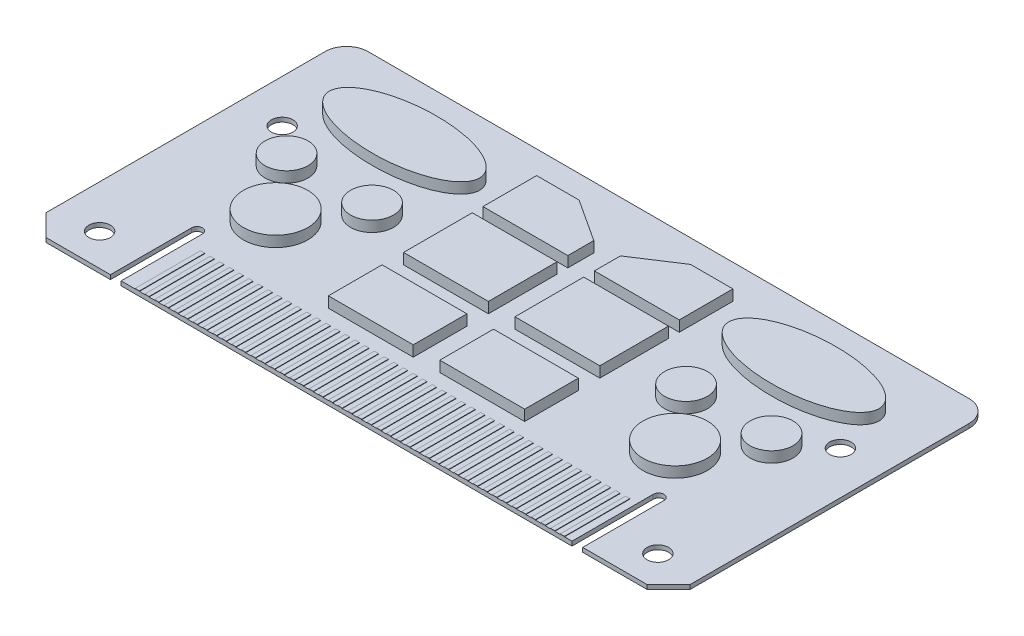
from build123d import *

# Parameters (mm, degrees)
SKETCH1_W                   = 300
SKETCH1_H                   = 150
BOSS_EXTRUDE3_DEPTH         = 2
CHAMFER2_SIZE               = 10
CHAMFER3_SIZE               = 10
FILLET1_R                   = 10
FILLET2_R                   = 10
SKETCH3_R                   = 5
CUT_EXTRUDE1_DEPTH          = 168.717023584
SKETCH4_R                   = 5
CUT_EXTRUDE2_DEPTH          = 168.717023584
CUT_EXTRUDE3_DEPTH          = 168.717023584
BOSS_EXTRUDE4_DEPTH         = 5
BOSS_EXTRUDE4_DEPTH_BACK    = 5
SKETCH6_RX                  = 35
SKETCH6_RY                  = 15
BOSS_EXTRUDE5_DEPTH         = 5
BOSS_EXTRUDE5_DEPTH_BACK    = 5
SKETCH7_R                   = 10
SKETCH7_R_2                 = 15
SKETCH7_W                   = 39.518903324
SKETCH7_H                   = 32
SKETCH7_H_2                 = 25
BOSS_EXTRUDE6_DEPTH         = 0.2
BOSS_EXTRUDE6_DEPTH_BACK    = 0.2
SKETCH12_W                  = 2
SKETCH12_H                  = 30.467504463
BOSS_EXTRUDE6_2_DEPTH       = 0.2
BOSS_EXTRUDE6_2_DEPTH_BACK  = 0.2
BOSS_EXTRUDE6_3_DEPTH       = 0.2
BOSS_EXTRUDE6_3_DEPTH_BACK  = 0.2
BOSS_EXTRUDE6_4_DEPTH       = 0.2
BOSS_EXTRUDE6_4_DEPTH_BACK  = 0.2
BOSS_EXTRUDE6_5_DEPTH       = 0.2
BOSS_EXTRUDE6_5_DEPTH_BACK  = 0.2
BOSS_EXTRUDE6_6_DEPTH       = 0.2
BOSS_EXTRUDE6_6_DEPTH_BACK  = 0.2
BOSS_EXTRUDE6_7_DEPTH       = 0.2
BOSS_EXTRUDE6_7_DEPTH_BACK  = 0.2
BOSS_EXTRUDE6_8_DEPTH       = 0.2
BOSS_EXTRUDE6_8_DEPTH_BACK  = 0.2
BOSS_EXTRUDE6_9_DEPTH       = 0.2
BOSS_EXTRUDE6_9_DEPTH_BACK  = 0.2
BOSS_EXTRUDE6_10_DEPTH      = 0.2
BOSS_EXTRUDE6_10_DEPTH_BACK = 0.2
BOSS_EXTRUDE6_11_DEPTH      = 0.2
BOSS_EXTRUDE6_11_DEPTH_BACK = 0.2
BOSS_EXTRUDE6_12_DEPTH      = 0.2
BOSS_EXTRUDE6_12_DEPTH_BACK = 0.2
BOSS_EXTRUDE6_13_DEPTH      = 0.2
BOSS_EXTRUDE6_13_DEPTH_BACK = 0.2
BOSS_EXTRUDE6_14_DEPTH      = 0.2
BOSS_EXTRUDE6_14_DEPTH_BACK = 0.2
BOSS_EXTRUDE6_15_DEPTH      = 0.2
BOSS_EXTRUDE6_15_DEPTH_BACK = 0.2
BOSS_EXTRUDE6_16_DEPTH      = 0.2
BOSS_EXTRUDE6_16_DEPTH_BACK = 0.2
BOSS_EXTRUDE6_17_DEPTH      = 0.2
BOSS_EXTRUDE6_17_DEPTH_BACK = 0.2
BOSS_EXTRUDE6_18_DEPTH      = 0.2
BOSS_EXTRUDE6_18_DEPTH_BACK = 0.2
BOSS_EXTRUDE6_19_DEPTH      = 0.2
BOSS_EXTRUDE6_19_DEPTH_BACK = 0.2
BOSS_EXTRUDE6_20_DEPTH      = 0.2
BOSS_EXTRUDE6_20_DEPTH_BACK = 0.2
BOSS_EXTRUDE6_21_DEPTH      = 0.2
BOSS_EXTRUDE6_21_DEPTH_BACK = 0.2
BOSS_EXTRUDE6_22_DEPTH      = 0.2
BOSS_EXTRUDE6_22_DEPTH_BACK = 0.2
BOSS_EXTRUDE6_23_DEPTH      = 0.2
BOSS_EXTRUDE6_23_DEPTH_BACK = 0.2
BOSS_EXTRUDE6_24_DEPTH      = 0.2
BOSS_EXTRUDE6_24_DEPTH_BACK = 0.2
BOSS_EXTRUDE6_25_DEPTH      = 0.2
BOSS_EXTRUDE6_25_DEPTH_BACK = 0.2
BOSS_EXTRUDE6_26_DEPTH      = 0.2
BOSS_EXTRUDE6_26_DEPTH_BACK = 0.2
BOSS_EXTRUDE6_27_DEPTH      = 0.2
BOSS_EXTRUDE6_27_DEPTH_BACK = 0.2
BOSS_EXTRUDE6_28_DEPTH      = 0.2
BOSS_EXTRUDE6_28_DEPTH_BACK = 0.2
BOSS_EXTRUDE6_29_DEPTH      = 0.2
BOSS_EXTRUDE6_29_DEPTH_BACK = 0.2
BOSS_EXTRUDE6_30_DEPTH      = 0.2
BOSS_EXTRUDE6_30_DEPTH_BACK = 0.2
BOSS_EXTRUDE6_31_DEPTH      = 0.2
BOSS_EXTRUDE6_31_DEPTH_BACK = 0.2
BOSS_EXTRUDE6_32_DEPTH      = 0.2
BOSS_EXTRUDE6_32_DEPTH_BACK = 0.2
BOSS_EXTRUDE6_33_DEPTH      = 0.2
BOSS_EXTRUDE6_33_DEPTH_BACK = 0.2
BOSS_EXTRUDE6_34_DEPTH      = 0.2
BOSS_EXTRUDE6_34_DEPTH_BACK = 0.2
BOSS_EXTRUDE6_35_DEPTH      = 0.2
BOSS_EXTRUDE6_35_DEPTH_BACK = 0.2
BOSS_EXTRUDE6_36_DEPTH      = 0.2
BOSS_EXTRUDE6_36_DEPTH_BACK = 0.2
BOSS_EXTRUDE6_37_DEPTH      = 0.2
BOSS_EXTRUDE6_37_DEPTH_BACK = 0.2
BOSS_EXTRUDE6_38_DEPTH      = 0.2
BOSS_EXTRUDE6_38_DEPTH_BACK = 0.2
BOSS_EXTRUDE6_39_DEPTH      = 0.2
BOSS_EXTRUDE6_39_DEPTH_BACK = 0.2
BOSS_EXTRUDE6_40_DEPTH      = 0.2
BOSS_EXTRUDE6_40_DEPTH_BACK = 0.2
BOSS_EXTRUDE6_41_DEPTH      = 0.2
BOSS_EXTRUDE6_41_DEPTH_BACK = 0.2
BOSS_EXTRUDE6_42_DEPTH      = 0.2
BOSS_EXTRUDE6_42_DEPTH_BACK = 0.2
BOSS_EXTRUDE6_43_DEPTH      = 0.2
BOSS_EXTRUDE6_43_DEPTH_BACK = 0.2
BOSS_EXTRUDE6_44_DEPTH      = 0.2
BOSS_EXTRUDE6_44_DEPTH_BACK = 0.2
BOSS_EXTRUDE6_45_DEPTH      = 0.2
BOSS_EXTRUDE6_45_DEPTH_BACK = 0.2


with BuildPart() as part:
    # Sketch1 → Boss-Extrude3 (new body)
    with BuildSketch(Plane(origin=(0, 0, 0), x_dir=(1, 0, 0), z_dir=(0, 1, 0))):
        Rectangle(SKETCH1_W, SKETCH1_H)
    extrude(amount=BOSS_EXTRUDE3_DEPTH)

    # Chamfer2
    chamfer2_edges = [part.edges().sort_by_distance(p)[0] for p in [
        (-150, 1, 75),
    ]]
    chamfer(chamfer2_edges, length=CHAMFER2_SIZE)

    # Chamfer3
    chamfer3_edges = [part.edges().sort_by_distance(p)[0] for p in [
        (150, 1, 75),
    ]]
    chamfer(chamfer3_edges, length=CHAMFER3_SIZE)

    # Fillet1
    fillet1_edges = [part.edges().sort_by_distance(p)[0] for p in [
        (150, 1, -75),
    ]]
    fillet(fillet1_edges, radius=FILLET1_R)

    # Fillet2
    fillet2_edges = [part.edges().sort_by_distance(p)[0] for p in [
        (-150, 1, -75),
    ]]
    fillet(fillet2_edges, radius=FILLET2_R)

    # Sketch3 → Cut-Extrude1 (cut, through all)
    with BuildSketch(Plane(origin=(0, 2, 0), x_dir=(1, 0, 0), z_dir=(0, 1, 0))):
        with Locations(Location((-130, -60, 0), (0, 0, 270))):
            Circle(SKETCH3_R)
        with Locations(Location((130, -60, 0), (0, 0, 90))):
            Circle(SKETCH3_R)
    extrude(amount=-CUT_EXTRUDE1_DEPTH, mode=Mode.SUBTRACT)

    # Sketch4 → Cut-Extrude2 (cut, through all)
    with BuildSketch(Plane(origin=(0, 2, 0), x_dir=(1, 0, 0), z_dir=(0, 1, 0))):
        with Locations(Location((-130, 25, 0), (0, 0, 270))):
            Circle(SKETCH4_R)
        with Locations(Location((130, 25, 0), (0, 0, 90))):
            Circle(SKETCH4_R)
    extrude(amount=-CUT_EXTRUDE2_DEPTH, mode=Mode.SUBTRACT)

    # Sketch5 → Cut-Extrude3 (cut, through all)
    with BuildSketch(Plane(origin=(0, 2, 0), x_dir=(1, 0, 0), z_dir=(0, 1, 0))):
        with BuildLine():
            Line((-110, -75), (-110, -37.159565813))
            ThreePointArc((-110, -37.159565813), (-107.5, -34.659565813), (-105, -37.159565813))
            Line((-105, -37.159565813), (-105, -75))
            ThreePointArc((-105, -75), (-107.5, -77.5), (-110, -75))
        make_face()
        with BuildLine():
            Line((110, -75), (110, -37.159565813))
            ThreePointArc((110, -37.159565813), (107.5, -34.659565813), (105, -37.159565813))
            Line((105, -37.159565813), (105, -75))
            ThreePointArc((105, -75), (107.5, -77.5), (110, -75))
        make_face()
    extrude(amount=-CUT_EXTRUDE3_DEPTH, mode=Mode.SUBTRACT)

    # Sketch6 → Boss-Extrude4 (add, two sides: drawn at the far end of the back side and taken through both)
    with BuildSketch(Plane(origin=(0, 2, 0), x_dir=(1, 0, 0), z_dir=(0, 1, 0)).offset(-BOSS_EXTRUDE4_DEPTH_BACK)):
        with Locations((-93.041409735, 45)):
            Ellipse(SKETCH6_RX, SKETCH6_RY)
        with Locations(Location((93.041409735, 45), (0, 0, 180))):
            Ellipse(SKETCH6_RX, SKETCH6_RY)
    extrude(amount=BOSS_EXTRUDE4_DEPTH + BOSS_EXTRUDE4_DEPTH_BACK)

    # Sketch7 → Boss-Extrude5 (add, two sides: drawn at the far end of the back side and taken through both)
    with BuildSketch(Plane(origin=(0, 2, 0), x_dir=(1, 0, 0), z_dir=(0, 1, 0)).offset(-BOSS_EXTRUDE5_DEPTH_BACK)):
        with Locations(Location((-112.953283382, 10, 0), (0, 0, 270))):
            Circle(SKETCH7_R)
        with Locations(Location((-73.129536087, 10, 0), (0, 0, 270))):
            Circle(SKETCH7_R)
        with Locations(Location((-93.041409735, -15, 0), (0, 0, 270))):
            Circle(SKETCH7_R_2)
        with Locations(Location((112.953283382, 10, 0), (0, 0, 270))):
            Circle(SKETCH7_R)
        with Locations(Location((93.041409735, -15, 0), (0, 0, 270))):
            Circle(SKETCH7_R_2)
        with Locations(Location((73.129536087, 10, 0), (0, 0, 270))):
            Circle(SKETCH7_R)
        Polygon((-25.952712631, 59.25059981), (-6.193260969, 46.355796771), (-6.193260969, 34.25059981), (-45.712164293, 34.25059981), (-45.712164293, 59.25059981), align=None)
        with Locations((-25.952712631, 13.25059981)):
            Rectangle(SKETCH7_W, SKETCH7_H)
        with Locations((-25.952712631, -25.24940019)):
            Rectangle(SKETCH7_W, SKETCH7_H_2)
        with Locations((25.952712631, -25.24940019)):
            Rectangle(SKETCH7_W, SKETCH7_H_2)
        with Locations((25.952712631, 13.25059981)):
            Rectangle(SKETCH7_W, SKETCH7_H)
        Polygon((45.712164293, 59.25059981), (25.952712631, 59.25059981), (6.193260969, 46.355796771), (6.193260969, 34.25059981), (45.712164293, 34.25059981), align=None)
    extrude(amount=BOSS_EXTRUDE5_DEPTH + BOSS_EXTRUDE5_DEPTH_BACK)


with BuildPart() as body_2:
    # Sketch12 → Boss-Extrude6 (new, two sides: drawn at the far end of the back side and taken through both)
    with BuildSketch(Plane(origin=(0, 2, 0), x_dir=(1, 0, 0), z_dir=(0, 1, 0)).offset(-BOSS_EXTRUDE6_DEPTH_BACK)):
        with Locations((-97.5, -59.766247769)):
            Rectangle(SKETCH12_W, SKETCH12_H)
    extrude(amount=BOSS_EXTRUDE6_DEPTH + BOSS_EXTRUDE6_DEPTH_BACK)


with BuildPart() as body_3:
    # Sketch12 → Boss-Extrude6 2 (new, two sides: drawn at the far end of the back side and taken through both)
    with BuildSketch(Plane(origin=(0, 2, 0), x_dir=(1, 0, 0), z_dir=(0, 1, 0)).offset(-BOSS_EXTRUDE6_2_DEPTH_BACK)):
        with Locations((-93, -59.766247769)):
            Rectangle(SKETCH12_W, SKETCH12_H)
    extrude(amount=BOSS_EXTRUDE6_2_DEPTH + BOSS_EXTRUDE6_2_DEPTH_BACK)


with BuildPart() as body_4:
    # Sketch12 → Boss-Extrude6 3 (new, two sides: drawn at the far end of the back side and taken through both)
    with BuildSketch(Plane(origin=(0, 2, 0), x_dir=(1, 0, 0), z_dir=(0, 1, 0)).offset(-BOSS_EXTRUDE6_3_DEPTH_BACK)):
        with Locations((-88.5, -59.766247769)):
            Rectangle(SKETCH12_W, SKETCH12_H)
    extrude(amount=BOSS_EXTRUDE6_3_DEPTH + BOSS_EXTRUDE6_3_DEPTH_BACK)


with BuildPart() as body_5:
    # Sketch12 → Boss-Extrude6 4 (new, two sides: drawn at the far end of the back side and taken through both)
    with BuildSketch(Plane(origin=(0, 2, 0), x_dir=(1, 0, 0), z_dir=(0, 1, 0)).offset(-BOSS_EXTRUDE6_4_DEPTH_BACK)):
        with Locations((-84, -59.766247769)):
            Rectangle(SKETCH12_W, SKETCH12_H)
    extrude(amount=BOSS_EXTRUDE6_4_DEPTH + BOSS_EXTRUDE6_4_DEPTH_BACK)


with BuildPart() as body_6:
    # Sketch12 → Boss-Extrude6 5 (new, two sides: drawn at the far end of the back side and taken through both)
    with BuildSketch(Plane(origin=(0, 2, 0), x_dir=(1, 0, 0), z_dir=(0, 1, 0)).offset(-BOSS_EXTRUDE6_5_DEPTH_BACK)):
        with Locations((-79.5, -59.766247769)):
            Rectangle(SKETCH12_W, SKETCH12_H)
    extrude(amount=BOSS_EXTRUDE6_5_DEPTH + BOSS_EXTRUDE6_5_DEPTH_BACK)


with BuildPart() as body_7:
    # Sketch12 → Boss-Extrude6 6 (new, two sides: drawn at the far end of the back side and taken through both)
    with BuildSketch(Plane(origin=(0, 2, 0), x_dir=(1, 0, 0), z_dir=(0, 1, 0)).offset(-BOSS_EXTRUDE6_6_DEPTH_BACK)):
        with Locations((-75, -59.766247769)):
            Rectangle(SKETCH12_W, SKETCH12_H)
    extrude(amount=BOSS_EXTRUDE6_6_DEPTH + BOSS_EXTRUDE6_6_DEPTH_BACK)


with BuildPart() as body_8:
    # Sketch12 → Boss-Extrude6 7 (new, two sides: drawn at the far end of the back side and taken through both)
    with BuildSketch(Plane(origin=(0, 2, 0), x_dir=(1, 0, 0), z_dir=(0, 1, 0)).offset(-BOSS_EXTRUDE6_7_DEPTH_BACK)):
        with Locations((-70.5, -59.766247769)):
            Rectangle(SKETCH12_W, SKETCH12_H)
    extrude(amount=BOSS_EXTRUDE6_7_DEPTH + BOSS_EXTRUDE6_7_DEPTH_BACK)


with BuildPart() as body_9:
    # Sketch12 → Boss-Extrude6 8 (new, two sides: drawn at the far end of the back side and taken through both)
    with BuildSketch(Plane(origin=(0, 2, 0), x_dir=(1, 0, 0), z_dir=(0, 1, 0)).offset(-BOSS_EXTRUDE6_8_DEPTH_BACK)):
        with Locations((-66, -59.766247769)):
            Rectangle(SKETCH12_W, SKETCH12_H)
    extrude(amount=BOSS_EXTRUDE6_8_DEPTH + BOSS_EXTRUDE6_8_DEPTH_BACK)


with BuildPart() as body_10:
    # Sketch12 → Boss-Extrude6 9 (new, two sides: drawn at the far end of the back side and taken through both)
    with BuildSketch(Plane(origin=(0, 2, 0), x_dir=(1, 0, 0), z_dir=(0, 1, 0)).offset(-BOSS_EXTRUDE6_9_DEPTH_BACK)):
        with Locations((-61.5, -59.766247769)):
            Rectangle(SKETCH12_W, SKETCH12_H)
    extrude(amount=BOSS_EXTRUDE6_9_DEPTH + BOSS_EXTRUDE6_9_DEPTH_BACK)


with BuildPart() as body_11:
    # Sketch12 → Boss-Extrude6 10 (new, two sides: drawn at the far end of the back side and taken through both)
    with BuildSketch(Plane(origin=(0, 2, 0), x_dir=(1, 0, 0), z_dir=(0, 1, 0)).offset(-BOSS_EXTRUDE6_10_DEPTH_BACK)):
        with Locations((-57, -59.766247769)):
            Rectangle(SKETCH12_W, SKETCH12_H)
    extrude(amount=BOSS_EXTRUDE6_10_DEPTH + BOSS_EXTRUDE6_10_DEPTH_BACK)


with BuildPart() as body_12:
    # Sketch12 → Boss-Extrude6 11 (new, two sides: drawn at the far end of the back side and taken through both)
    with BuildSketch(Plane(origin=(0, 2, 0), x_dir=(1, 0, 0), z_dir=(0, 1, 0)).offset(-BOSS_EXTRUDE6_11_DEPTH_BACK)):
        with Locations((-52.5, -59.766247769)):
            Rectangle(SKETCH12_W, SKETCH12_H)
    extrude(amount=BOSS_EXTRUDE6_11_DEPTH + BOSS_EXTRUDE6_11_DEPTH_BACK)


with BuildPart() as body_13:
    # Sketch12 → Boss-Extrude6 12 (new, two sides: drawn at the far end of the back side and taken through both)
    with BuildSketch(Plane(origin=(0, 2, 0), x_dir=(1, 0, 0), z_dir=(0, 1, 0)).offset(-BOSS_EXTRUDE6_12_DEPTH_BACK)):
        with Locations((-48, -59.766247769)):
            Rectangle(SKETCH12_W, SKETCH12_H)
    extrude(amount=BOSS_EXTRUDE6_12_DEPTH + BOSS_EXTRUDE6_12_DEPTH_BACK)


with BuildPart() as body_14:
    # Sketch12 → Boss-Extrude6 13 (new, two sides: drawn at the far end of the back side and taken through both)
    with BuildSketch(Plane(origin=(0, 2, 0), x_dir=(1, 0, 0), z_dir=(0, 1, 0)).offset(-BOSS_EXTRUDE6_13_DEPTH_BACK)):
        with Locations((-43.5, -59.766247769)):
            Rectangle(SKETCH12_W, SKETCH12_H)
    extrude(amount=BOSS_EXTRUDE6_13_DEPTH + BOSS_EXTRUDE6_13_DEPTH_BACK)


with BuildPart() as body_15:
    # Sketch12 → Boss-Extrude6 14 (new, two sides: drawn at the far end of the back side and taken through both)
    with BuildSketch(Plane(origin=(0, 2, 0), x_dir=(1, 0, 0), z_dir=(0, 1, 0)).offset(-BOSS_EXTRUDE6_14_DEPTH_BACK)):
        with Locations((-39, -59.766247769)):
            Rectangle(SKETCH12_W, SKETCH12_H)
    extrude(amount=BOSS_EXTRUDE6_14_DEPTH + BOSS_EXTRUDE6_14_DEPTH_BACK)


with BuildPart() as body_16:
    # Sketch12 → Boss-Extrude6 15 (new, two sides: drawn at the far end of the back side and taken through both)
    with BuildSketch(Plane(origin=(0, 2, 0), x_dir=(1, 0, 0), z_dir=(0, 1, 0)).offset(-BOSS_EXTRUDE6_15_DEPTH_BACK)):
        with Locations((-34.5, -59.766247769)):
            Rectangle(SKETCH12_W, SKETCH12_H)
    extrude(amount=BOSS_EXTRUDE6_15_DEPTH + BOSS_EXTRUDE6_15_DEPTH_BACK)


with BuildPart() as body_17:
    # Sketch12 → Boss-Extrude6 16 (new, two sides: drawn at the far end of the back side and taken through both)
    with BuildSketch(Plane(origin=(0, 2, 0), x_dir=(1, 0, 0), z_dir=(0, 1, 0)).offset(-BOSS_EXTRUDE6_16_DEPTH_BACK)):
        with Locations((-30, -59.766247769)):
            Rectangle(SKETCH12_W, SKETCH12_H)
    extrude(amount=BOSS_EXTRUDE6_16_DEPTH + BOSS_EXTRUDE6_16_DEPTH_BACK)


with BuildPart() as body_18:
    # Sketch12 → Boss-Extrude6 17 (new, two sides: drawn at the far end of the back side and taken through both)
    with BuildSketch(Plane(origin=(0, 2, 0), x_dir=(1, 0, 0), z_dir=(0, 1, 0)).offset(-BOSS_EXTRUDE6_17_DEPTH_BACK)):
        with Locations((-25.5, -59.766247769)):
            Rectangle(SKETCH12_W, SKETCH12_H)
    extrude(amount=BOSS_EXTRUDE6_17_DEPTH + BOSS_EXTRUDE6_17_DEPTH_BACK)


with BuildPart() as body_19:
    # Sketch12 → Boss-Extrude6 18 (new, two sides: drawn at the far end of the back side and taken through both)
    with BuildSketch(Plane(origin=(0, 2, 0), x_dir=(1, 0, 0), z_dir=(0, 1, 0)).offset(-BOSS_EXTRUDE6_18_DEPTH_BACK)):
        with Locations((-21, -59.766247769)):
            Rectangle(SKETCH12_W, SKETCH12_H)
    extrude(amount=BOSS_EXTRUDE6_18_DEPTH + BOSS_EXTRUDE6_18_DEPTH_BACK)


with BuildPart() as body_20:
    # Sketch12 → Boss-Extrude6 19 (new, two sides: drawn at the far end of the back side and taken through both)
    with BuildSketch(Plane(origin=(0, 2, 0), x_dir=(1, 0, 0), z_dir=(0, 1, 0)).offset(-BOSS_EXTRUDE6_19_DEPTH_BACK)):
        with Locations((-16.5, -59.766247769)):
            Rectangle(SKETCH12_W, SKETCH12_H)
    extrude(amount=BOSS_EXTRUDE6_19_DEPTH + BOSS_EXTRUDE6_19_DEPTH_BACK)


with BuildPart() as body_21:
    # Sketch12 → Boss-Extrude6 20 (new, two sides: drawn at the far end of the back side and taken through both)
    with BuildSketch(Plane(origin=(0, 2, 0), x_dir=(1, 0, 0), z_dir=(0, 1, 0)).offset(-BOSS_EXTRUDE6_20_DEPTH_BACK)):
        with Locations((-12, -59.766247769)):
            Rectangle(SKETCH12_W, SKETCH12_H)
    extrude(amount=BOSS_EXTRUDE6_20_DEPTH + BOSS_EXTRUDE6_20_DEPTH_BACK)


with BuildPart() as body_22:
    # Sketch12 → Boss-Extrude6 21 (new, two sides: drawn at the far end of the back side and taken through both)
    with BuildSketch(Plane(origin=(0, 2, 0), x_dir=(1, 0, 0), z_dir=(0, 1, 0)).offset(-BOSS_EXTRUDE6_21_DEPTH_BACK)):
        with Locations((-7.5, -59.766247769)):
            Rectangle(SKETCH12_W, SKETCH12_H)
    extrude(amount=BOSS_EXTRUDE6_21_DEPTH + BOSS_EXTRUDE6_21_DEPTH_BACK)


with BuildPart() as body_23:
    # Sketch12 → Boss-Extrude6 22 (new, two sides: drawn at the far end of the back side and taken through both)
    with BuildSketch(Plane(origin=(0, 2, 0), x_dir=(1, 0, 0), z_dir=(0, 1, 0)).offset(-BOSS_EXTRUDE6_22_DEPTH_BACK)):
        with Locations((-3, -59.766247769)):
            Rectangle(SKETCH12_W, SKETCH12_H)
    extrude(amount=BOSS_EXTRUDE6_22_DEPTH + BOSS_EXTRUDE6_22_DEPTH_BACK)


with BuildPart() as body_24:
    # Sketch12 → Boss-Extrude6 23 (new, two sides: drawn at the far end of the back side and taken through both)
    with BuildSketch(Plane(origin=(0, 2, 0), x_dir=(1, 0, 0), z_dir=(0, 1, 0)).offset(-BOSS_EXTRUDE6_23_DEPTH_BACK)):
        with Locations((1.5, -59.766247769)):
            Rectangle(SKETCH12_W, SKETCH12_H)
    extrude(amount=BOSS_EXTRUDE6_23_DEPTH + BOSS_EXTRUDE6_23_DEPTH_BACK)


with BuildPart() as body_25:
    # Sketch12 → Boss-Extrude6 24 (new, two sides: drawn at the far end of the back side and taken through both)
    with BuildSketch(Plane(origin=(0, 2, 0), x_dir=(1, 0, 0), z_dir=(0, 1, 0)).offset(-BOSS_EXTRUDE6_24_DEPTH_BACK)):
        with Locations((6, -59.766247769)):
            Rectangle(SKETCH12_W, SKETCH12_H)
    extrude(amount=BOSS_EXTRUDE6_24_DEPTH + BOSS_EXTRUDE6_24_DEPTH_BACK)


with BuildPart() as body_26:
    # Sketch12 → Boss-Extrude6 25 (new, two sides: drawn at the far end of the back side and taken through both)
    with BuildSketch(Plane(origin=(0, 2, 0), x_dir=(1, 0, 0), z_dir=(0, 1, 0)).offset(-BOSS_EXTRUDE6_25_DEPTH_BACK)):
        with Locations((10.5, -59.766247769)):
            Rectangle(SKETCH12_W, SKETCH12_H)
    extrude(amount=BOSS_EXTRUDE6_25_DEPTH + BOSS_EXTRUDE6_25_DEPTH_BACK)


with BuildPart() as body_27:
    # Sketch12 → Boss-Extrude6 26 (new, two sides: drawn at the far end of the back side and taken through both)
    with BuildSketch(Plane(origin=(0, 2, 0), x_dir=(1, 0, 0), z_dir=(0, 1, 0)).offset(-BOSS_EXTRUDE6_26_DEPTH_BACK)):
        with Locations((15, -59.766247769)):
            Rectangle(SKETCH12_W, SKETCH12_H)
    extrude(amount=BOSS_EXTRUDE6_26_DEPTH + BOSS_EXTRUDE6_26_DEPTH_BACK)


with BuildPart() as body_28:
    # Sketch12 → Boss-Extrude6 27 (new, two sides: drawn at the far end of the back side and taken through both)
    with BuildSketch(Plane(origin=(0, 2, 0), x_dir=(1, 0, 0), z_dir=(0, 1, 0)).offset(-BOSS_EXTRUDE6_27_DEPTH_BACK)):
        with Locations((19.5, -59.766247769)):
            Rectangle(SKETCH12_W, SKETCH12_H)
    extrude(amount=BOSS_EXTRUDE6_27_DEPTH + BOSS_EXTRUDE6_27_DEPTH_BACK)


with BuildPart() as body_29:
    # Sketch12 → Boss-Extrude6 28 (new, two sides: drawn at the far end of the back side and taken through both)
    with BuildSketch(Plane(origin=(0, 2, 0), x_dir=(1, 0, 0), z_dir=(0, 1, 0)).offset(-BOSS_EXTRUDE6_28_DEPTH_BACK)):
        with Locations((24, -59.766247769)):
            Rectangle(SKETCH12_W, SKETCH12_H)
    extrude(amount=BOSS_EXTRUDE6_28_DEPTH + BOSS_EXTRUDE6_28_DEPTH_BACK)


with BuildPart() as body_30:
    # Sketch12 → Boss-Extrude6 29 (new, two sides: drawn at the far end of the back side and taken through both)
    with BuildSketch(Plane(origin=(0, 2, 0), x_dir=(1, 0, 0), z_dir=(0, 1, 0)).offset(-BOSS_EXTRUDE6_29_DEPTH_BACK)):
        with Locations((28.5, -59.766247769)):
            Rectangle(SKETCH12_W, SKETCH12_H)
    extrude(amount=BOSS_EXTRUDE6_29_DEPTH + BOSS_EXTRUDE6_29_DEPTH_BACK)


with BuildPart() as body_31:
    # Sketch12 → Boss-Extrude6 30 (new, two sides: drawn at the far end of the back side and taken through both)
    with BuildSketch(Plane(origin=(0, 2, 0), x_dir=(1, 0, 0), z_dir=(0, 1, 0)).offset(-BOSS_EXTRUDE6_30_DEPTH_BACK)):
        with Locations((33, -59.766247769)):
            Rectangle(SKETCH12_W, SKETCH12_H)
    extrude(amount=BOSS_EXTRUDE6_30_DEPTH + BOSS_EXTRUDE6_30_DEPTH_BACK)


with BuildPart() as body_32:
    # Sketch12 → Boss-Extrude6 31 (new, two sides: drawn at the far end of the back side and taken through both)
    with BuildSketch(Plane(origin=(0, 2, 0), x_dir=(1, 0, 0), z_dir=(0, 1, 0)).offset(-BOSS_EXTRUDE6_31_DEPTH_BACK)):
        with Locations((37.5, -59.766247769)):
            Rectangle(SKETCH12_W, SKETCH12_H)
    extrude(amount=BOSS_EXTRUDE6_31_DEPTH + BOSS_EXTRUDE6_31_DEPTH_BACK)


with BuildPart() as body_33:
    # Sketch12 → Boss-Extrude6 32 (new, two sides: drawn at the far end of the back side and taken through both)
    with BuildSketch(Plane(origin=(0, 2, 0), x_dir=(1, 0, 0), z_dir=(0, 1, 0)).offset(-BOSS_EXTRUDE6_32_DEPTH_BACK)):
        with Locations((42, -59.766247769)):
            Rectangle(SKETCH12_W, SKETCH12_H)
    extrude(amount=BOSS_EXTRUDE6_32_DEPTH + BOSS_EXTRUDE6_32_DEPTH_BACK)


with BuildPart() as body_34:
    # Sketch12 → Boss-Extrude6 33 (new, two sides: drawn at the far end of the back side and taken through both)
    with BuildSketch(Plane(origin=(0, 2, 0), x_dir=(1, 0, 0), z_dir=(0, 1, 0)).offset(-BOSS_EXTRUDE6_33_DEPTH_BACK)):
        with Locations((46.5, -59.766247769)):
            Rectangle(SKETCH12_W, SKETCH12_H)
    extrude(amount=BOSS_EXTRUDE6_33_DEPTH + BOSS_EXTRUDE6_33_DEPTH_BACK)


with BuildPart() as body_35:
    # Sketch12 → Boss-Extrude6 34 (new, two sides: drawn at the far end of the back side and taken through both)
    with BuildSketch(Plane(origin=(0, 2, 0), x_dir=(1, 0, 0), z_dir=(0, 1, 0)).offset(-BOSS_EXTRUDE6_34_DEPTH_BACK)):
        with Locations((51, -59.766247769)):
            Rectangle(SKETCH12_W, SKETCH12_H)
    extrude(amount=BOSS_EXTRUDE6_34_DEPTH + BOSS_EXTRUDE6_34_DEPTH_BACK)


with BuildPart() as body_36:
    # Sketch12 → Boss-Extrude6 35 (new, two sides: drawn at the far end of the back side and taken through both)
    with BuildSketch(Plane(origin=(0, 2, 0), x_dir=(1, 0, 0), z_dir=(0, 1, 0)).offset(-BOSS_EXTRUDE6_35_DEPTH_BACK)):
        with Locations((55.5, -59.766247769)):
            Rectangle(SKETCH12_W, SKETCH12_H)
    extrude(amount=BOSS_EXTRUDE6_35_DEPTH + BOSS_EXTRUDE6_35_DEPTH_BACK)


with BuildPart() as body_37:
    # Sketch12 → Boss-Extrude6 36 (new, two sides: drawn at the far end of the back side and taken through both)
    with BuildSketch(Plane(origin=(0, 2, 0), x_dir=(1, 0, 0), z_dir=(0, 1, 0)).offset(-BOSS_EXTRUDE6_36_DEPTH_BACK)):
        with Locations((60, -59.766247769)):
            Rectangle(SKETCH12_W, SKETCH12_H)
    extrude(amount=BOSS_EXTRUDE6_36_DEPTH + BOSS_EXTRUDE6_36_DEPTH_BACK)


with BuildPart() as body_38:
    # Sketch12 → Boss-Extrude6 37 (new, two sides: drawn at the far end of the back side and taken through both)
    with BuildSketch(Plane(origin=(0, 2, 0), x_dir=(1, 0, 0), z_dir=(0, 1, 0)).offset(-BOSS_EXTRUDE6_37_DEPTH_BACK)):
        with Locations((64.5, -59.766247769)):
            Rectangle(SKETCH12_W, SKETCH12_H)
    extrude(amount=BOSS_EXTRUDE6_37_DEPTH + BOSS_EXTRUDE6_37_DEPTH_BACK)


with BuildPart() as body_39:
    # Sketch12 → Boss-Extrude6 38 (new, two sides: drawn at the far end of the back side and taken through both)
    with BuildSketch(Plane(origin=(0, 2, 0), x_dir=(1, 0, 0), z_dir=(0, 1, 0)).offset(-BOSS_EXTRUDE6_38_DEPTH_BACK)):
        with Locations((69, -59.766247769)):
            Rectangle(SKETCH12_W, SKETCH12_H)
    extrude(amount=BOSS_EXTRUDE6_38_DEPTH + BOSS_EXTRUDE6_38_DEPTH_BACK)


with BuildPart() as body_40:
    # Sketch12 → Boss-Extrude6 39 (new, two sides: drawn at the far end of the back side and taken through both)
    with BuildSketch(Plane(origin=(0, 2, 0), x_dir=(1, 0, 0), z_dir=(0, 1, 0)).offset(-BOSS_EXTRUDE6_39_DEPTH_BACK)):
        with Locations((73.5, -59.766247769)):
            Rectangle(SKETCH12_W, SKETCH12_H)
    extrude(amount=BOSS_EXTRUDE6_39_DEPTH + BOSS_EXTRUDE6_39_DEPTH_BACK)


with BuildPart() as body_41:
    # Sketch12 → Boss-Extrude6 40 (new, two sides: drawn at the far end of the back side and taken through both)
    with BuildSketch(Plane(origin=(0, 2, 0), x_dir=(1, 0, 0), z_dir=(0, 1, 0)).offset(-BOSS_EXTRUDE6_40_DEPTH_BACK)):
        with Locations((78, -59.766247769)):
            Rectangle(SKETCH12_W, SKETCH12_H)
    extrude(amount=BOSS_EXTRUDE6_40_DEPTH + BOSS_EXTRUDE6_40_DEPTH_BACK)


with BuildPart() as body_42:
    # Sketch12 → Boss-Extrude6 41 (new, two sides: drawn at the far end of the back side and taken through both)
    with BuildSketch(Plane(origin=(0, 2, 0), x_dir=(1, 0, 0), z_dir=(0, 1, 0)).offset(-BOSS_EXTRUDE6_41_DEPTH_BACK)):
        with Locations((82.5, -59.766247769)):
            Rectangle(SKETCH12_W, SKETCH12_H)
    extrude(amount=BOSS_EXTRUDE6_41_DEPTH + BOSS_EXTRUDE6_41_DEPTH_BACK)


with BuildPart() as body_43:
    # Sketch12 → Boss-Extrude6 42 (new, two sides: drawn at the far end of the back side and taken through both)
    with BuildSketch(Plane(origin=(0, 2, 0), x_dir=(1, 0, 0), z_dir=(0, 1, 0)).offset(-BOSS_EXTRUDE6_42_DEPTH_BACK)):
        with Locations((87, -59.766247769)):
            Rectangle(SKETCH12_W, SKETCH12_H)
    extrude(amount=BOSS_EXTRUDE6_42_DEPTH + BOSS_EXTRUDE6_42_DEPTH_BACK)


with BuildPart() as body_44:
    # Sketch12 → Boss-Extrude6 43 (new, two sides: drawn at the far end of the back side and taken through both)
    with BuildSketch(Plane(origin=(0, 2, 0), x_dir=(1, 0, 0), z_dir=(0, 1, 0)).offset(-BOSS_EXTRUDE6_43_DEPTH_BACK)):
        with Locations((91.5, -59.766247769)):
            Rectangle(SKETCH12_W, SKETCH12_H)
    extrude(amount=BOSS_EXTRUDE6_43_DEPTH + BOSS_EXTRUDE6_43_DEPTH_BACK)


with BuildPart() as body_45:
    # Sketch12 → Boss-Extrude6 44 (new, two sides: drawn at the far end of the back side and taken through both)
    with BuildSketch(Plane(origin=(0, 2, 0), x_dir=(1, 0, 0), z_dir=(0, 1, 0)).offset(-BOSS_EXTRUDE6_44_DEPTH_BACK)):
        with Locations((96, -59.766247769)):
            Rectangle(SKETCH12_W, SKETCH12_H)
    extrude(amount=BOSS_EXTRUDE6_44_DEPTH + BOSS_EXTRUDE6_44_DEPTH_BACK)


with BuildPart() as body_46:
    # Sketch12 → Boss-Extrude6 45 (new, two sides: drawn at the far end of the back side and taken through both)
    with BuildSketch(Plane(origin=(0, 2, 0), x_dir=(1, 0, 0), z_dir=(0, 1, 0)).offset(-BOSS_EXTRUDE6_45_DEPTH_BACK)):
        with Locations((100.5, -59.766247769)):
            Rectangle(SKETCH12_W, SKETCH12_H)
    extrude(amount=BOSS_EXTRUDE6_45_DEPTH + BOSS_EXTRUDE6_45_DEPTH_BACK)


solid = Compound([part.part, body_2.part, body_3.part, body_4.part, body_5.part, body_6.part, body_7.part, body_8.part, body_9.part, body_10.part, body_11.part, body_12.part, body_13.part, body_14.part, body_15.part, body_16.part, body_17.part, body_18.part, body_19.part, body_20.part, body_21.part, body_22.part, body_23.part, body_24.part, body_25.part, body_26.part, body_27.part, body_28.part, body_29.part, body_30.part, body_31.part, body_32.part, body_33.part, body_34.part, body_35.part, body_36.part, body_37.part, body_38.part, body_39.part, body_40.part, body_41.part, body_42.part, body_43.part, body_44.part, body_45.part, body_46.part])
